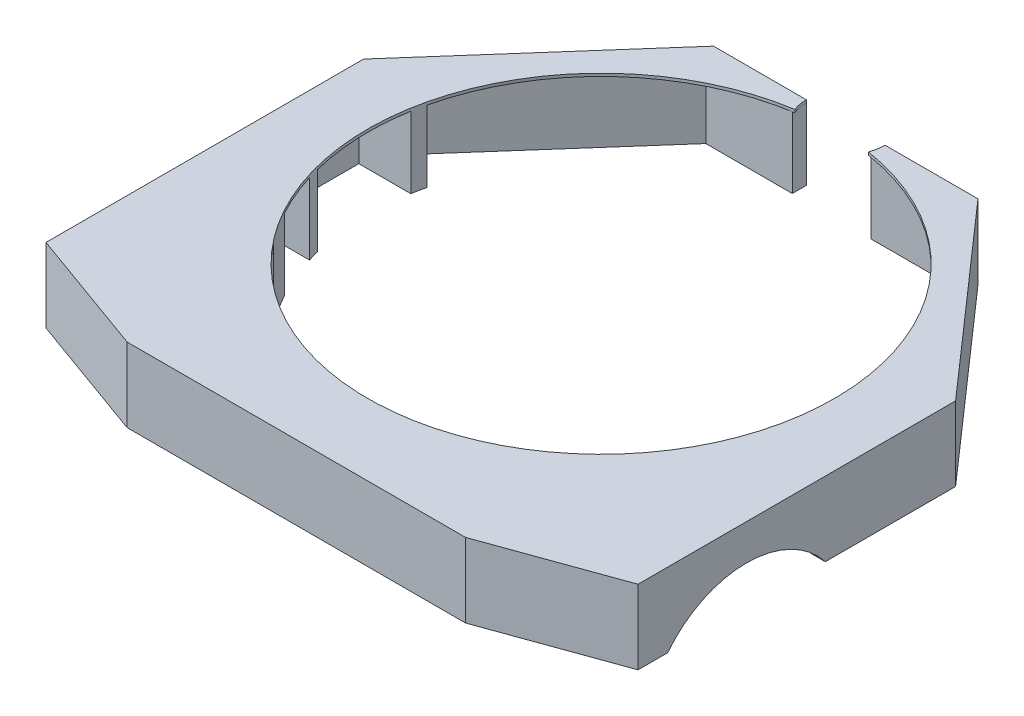
from build123d import *

# Parameters (mm, degrees)
BOSS_EXTRUDE1_DEPTH     = 63.399999946
BOSS_EXTRUDE2_DEPTH     = 63.399999946
BOSS_EXTRUDE3_DEPTH     = 5
BOSS_EXTRUDE4_DEPTH     = 2.5
SKETCH8_W               = 50.000000076
SKETCH8_H               = 34.99999985
CUT_EXTRUDE2_DEPTH      = 12.5
CUT_EXTRUDE4_DEPTH      = 2.5
SKETCH10_W              = 9.999999939
SKETCH10_H              = 34.99999985
CUT_EXTRUDE5_DEPTH      = 2.5
BOSS_EXTRUDE6_DEPTH     = 58.399999946
BOSS_EXTRUDE7_DEPTH     = 63.399999946
CUT_EXTRUDE8_DEPTH      = 633.390638366
CUT_EXTRUDE8_DEPTH_BACK = 633.390638366
SKETCH13_R              = 207.367939984
CUT_EXTRUDE9_DEPTH      = 465.722133037
BOSS_EXTRUDE15_DEPTH    = 63.4


with BuildPart() as part:
    # Sketch1 → Boss-Extrude1 (new body)
    with BuildSketch(Plane(origin=(0, 0, 0), x_dir=(1, 0, 0), z_dir=(0, 1, 0))):
        Polygon((-304.507375635, 63.663075045), (-304.507375635, -102.743315535), (-191.856739857, -143.33813924), (108.841988943, -143.33813924), (221.492624721, -102.743315535), (221.492624721, 63.663075045), (218.992624721, 63.663075045), (218.992624721, -100.986845182), (108.405283491, -140.83813932), (-191.420034405, -140.83813932), (-302.007375635, -100.986845182), (-302.007375635, 63.663075045), align=None)
    extrude(amount=BOSS_EXTRUDE1_DEPTH)



with BuildPart() as body_2:
    # Sketch3 → Boss-Extrude2 (new body)
    with BuildSketch(Plane(origin=(0, 0, 0), x_dir=(1, 0, 0), z_dir=(0, 1, 0))):
        Polygon((-304.507375635, 179.416332489), (-159.011838483, 344.817501188), (75.997087569, 344.817501188), (221.492624721, 179.416332489), (221.492624721, 63.663075045), (218.992624721, 63.663075045), (218.992624721, 178.473242754), (74.866627441, 342.317501188), (-157.881378355, 342.317501188), (-302.007375635, 178.473242754), (-302.007375635, 63.663075045), (-304.507375635, 63.663075045), align=None)
    extrude(amount=BOSS_EXTRUDE2_DEPTH)


with BuildPart() as part_1:
    add(part.part)

    add(body_2.part)  # Boss-Extrude3 merges body 2
    # Sketch5 → Boss-Extrude3 (add)
    with BuildSketch(Plane(origin=(0, 0, 0), x_dir=(1, 0, 0), z_dir=(0, 1, 0))):
        Polygon((208.992624721, 174.700883815), (208.992624721, 63.663075045), (218.992624721, 63.663075045), (218.992624721, 178.473242754), (74.866627441, 342.317501188), (-157.881378355, 342.317501188), (-302.007375635, 178.473242754), (-302.007375635, 63.663075045), (-292.007375635, 63.663075045), (-292.007375635, 174.700883815), (-153.359537842, 332.317501188), (70.344786927, 332.317501188), align=None)
        Polygon((215.602428975, -91.579051987), (106.658461628, -130.83813932), (-189.673212543, -130.83813932), (-298.617179889, -91.579051987), (-302.007375635, -100.986845182), (-191.420034405, -140.83813932), (108.405283491, -140.83813932), (218.992624721, -100.986845182), align=None)
    extrude(amount=BOSS_EXTRUDE3_DEPTH)

    # Sketch6 → Boss-Extrude4 (add)
    with BuildSketch(Plane(origin=(0, 63.399999946, 0), x_dir=(1, 0, 0), z_dir=(0, 1, 0))):
        Polygon((-159.011838483, 344.817501188), (-304.507375635, 179.416332489), (-304.507375635, -102.743315535), (-191.856739857, -143.33813924), (108.841988943, -143.33813924), (221.492624721, -102.743315535), (221.492624721, 179.416332489), (75.997087569, 344.817501188), align=None)
    extrude(amount=BOSS_EXTRUDE4_DEPTH)

    # Sketch8 → Cut-Extrude2 (cut)
    with BuildSketch(Plane(origin=(0, 0, -344.817501188), x_dir=(-1, 0, 0), z_dir=(0, 0, -1))):
        Polygon((6.50737548, 28.400000096), (6.50737548, 0), (76.507375434, 0), (76.507375434, 28.400000096), (66.507375495, 28.400000096), (16.507375419, 28.400000096), align=None)
        with Locations((41.507375457, 45.900000021)):
            Rectangle(SKETCH8_W, SKETCH8_H)
    extrude(amount=-CUT_EXTRUDE2_DEPTH, mode=Mode.SUBTRACT)

    # Sketch9 → Cut-Extrude4 (cut)
    with BuildSketch(Plane(origin=(0, 65.899999946, 0), x_dir=(1, 0, 0), z_dir=(0, 1, 0))):
        with BuildLine():
            ThreePointArc((-76.507375434, 344.817501188), (-41.507375457, 309.817501211), (-6.50737548, 344.817501188))
            Line((-6.50737548, 344.817501188), (-16.507375419, 344.817501188))
            Line((-16.507375419, 344.817501188), (-66.507375495, 344.817501188))
            Line((-66.507375495, 344.817501188), (-76.507375434, 344.817501188))
        make_face()
        with BuildLine():
            Line((-16.507375419, 344.817501188), (-6.50737548, 344.817501188))
            ThreePointArc((-6.50737548, 344.817501188), (-41.507375457, 379.817501165), (-76.507375434, 344.817501188))
            Line((-76.507375434, 344.817501188), (-66.507375495, 344.817501188))
            Line((-66.507375495, 344.817501188), (-16.507375419, 344.817501188))
        make_face()
    extrude(amount=-CUT_EXTRUDE4_DEPTH, mode=Mode.SUBTRACT)

    # Sketch10 → Cut-Extrude5 (cut)
    with BuildSketch(Plane(origin=(0, 0, -344.817501188), x_dir=(-1, 0, 0), z_dir=(0, 0, -1))):
        with Locations((11.50737545, 45.900000021)):
            Rectangle(SKETCH10_W, SKETCH10_H)
        with Locations((71.507375465, 45.900000021)):
            Rectangle(SKETCH10_W, SKETCH10_H)
    extrude(amount=-CUT_EXTRUDE5_DEPTH, mode=Mode.SUBTRACT)

    # Sketch11 → Boss-Extrude6 (add)
    with BuildSketch(Plane(origin=(0, 5, 0), x_dir=(1, 0, 0), z_dir=(0, 1, 0))):
        Polygon((-76.507375434, 332.317501188), (-76.507375434, 342.317501188), (-157.881378355, 342.317501188), (-302.007375635, 178.473242754), (-302.007375635, 63.663075045), (-292.007375635, 63.663075045), (-292.007375635, 174.700883815), (-153.359537842, 332.317501188), align=None)
        Polygon((208.992624721, 63.663075045), (218.992624721, 63.663075045), (218.992624721, 178.473242754), (74.866627441, 342.317501188), (-6.50737548, 342.317501188), (-6.50737548, 332.317501188), (70.344786927, 332.317501188), (208.992624721, 174.700883815), align=None)
        Polygon((108.405283491, -140.83813932), (218.992624721, -100.986845182), (215.602428975, -91.579051987), (106.658461628, -130.83813932), (-189.673212543, -130.83813932), (-298.617179889, -91.579051987), (-302.007375635, -100.986845182), (-191.420034405, -140.83813932), align=None)
    extrude(amount=BOSS_EXTRUDE6_DEPTH)

    # Sketch12 → Boss-Extrude7 (add)
    with BuildSketch(Plane.XZ):
        Polygon((-302.007375635, 100.986845182), (-302.007375635, -63.663075045), (-292.007375635, -63.663075045), (-292.007375635, 93.96096343), (-298.617179889, 91.579051987), align=None)
        Polygon((218.992624721, 100.986845182), (218.992624721, -63.663075045), (208.992624721, -63.663075045), (208.992624721, 93.96096343), (215.602428975, 91.579051987), align=None)
    extrude(amount=-BOSS_EXTRUDE7_DEPTH)

    # Sketch2 → Cut-Extrude8 (cut, two sides: drawn at the far end of the back side and taken through both)
    with BuildSketch(Plane.ZY.offset(304.507375635).offset(-CUT_EXTRUDE8_DEPTH_BACK)):
        with BuildLine():
            ThreePointArc((-63.663075045, 0), (-22.645494652, -138.842602216), (95.238139156, -54.800000095))
            ThreePointArc((95.238139156, -54.800000095), (90.380741277, -25.816366286), (76.339353357, 0))
            Line((76.339353357, 0), (-63.663075045, 0))
        make_face()
        with BuildLine():
            Line((-63.663075045, 0), (76.339353357, 0))
            ThreePointArc((76.339353357, 0), (6.338139156, 34.099999905), (-63.663075045, 0))
        make_face()
    extrude(amount=CUT_EXTRUDE8_DEPTH + CUT_EXTRUDE8_DEPTH_BACK, mode=Mode.SUBTRACT)

    # Sketch13 → Cut-Extrude9 (cut, through all)
    with BuildSketch(Plane(origin=(0, 65.899999946, 0), x_dir=(1, 0, 0), z_dir=(0, 1, 0))):
        with Locations((-41.507375457, 127.449561204)):
            Circle(SKETCH13_R)
    extrude(amount=-CUT_EXTRUDE9_DEPTH, mode=Mode.SUBTRACT)

    # Sketch16 → Boss-Extrude15 (add, through all)
    with BuildSketch(Plane.XZ.offset(-63.399999946)):
        with BuildLine():
            Line((-292.007375635, -174.700883815), (-243.420166148, -174.700883815))
            ThreePointArc((-243.420166148, -174.700883815), (-244.727222578, -168.718875101), (-245.857092333, -162.700883815))
            Line((-245.857092333, -162.700883815), (-292.007375635, -162.700883815))
            Line((-292.007375635, -162.700883815), (-292.007375635, -174.700883815))
        make_face()
        with BuildLine():
            Line((-292.007375635, -66.656438986), (-239.763923455, -66.656438986))
            ThreePointArc((-239.763923455, -66.656438986), (-241.223768745, -71.638945859), (-242.558416908, -76.656438986))
            Line((-242.558416908, -76.656438986), (-292.007375635, -76.656438986))
            Line((-292.007375635, -76.656438986), (-292.007375635, -66.656438986))
        make_face()
        with BuildLine():
            Line((-223.513560978, 118.643419163), (-223.513560978, -28.075465156))
            ThreePointArc((-223.513560978, -28.075465156), (-214.696000108, -13.400611956), (-204.697974588, 0.496876373))
            Line((-204.697974588, 0.496876373), (-204.697974588, 125.423810655))
            Line((-204.697974588, 125.423810655), (-223.513560978, 118.643419163))
        make_face()
        with BuildLine():
            Line((-189.673212543, 130.83813932), (-189.673212543, 17.63092423))
            ThreePointArc((-189.673212543, 17.63092423), (-182.344298329, 24.755641365), (-174.673212543, 31.510567025))
            Line((-174.673212543, 31.510567025), (-174.673212543, 115.83813932))
            Line((-174.673212543, 115.83813932), (91.658461628, 115.83813932))
            Line((91.658461628, 115.83813932), (91.658461628, 31.510567025))
            ThreePointArc((91.658461628, 31.510567025), (99.329547415, 24.755641365), (106.658461628, 17.63092423))
            Line((106.658461628, 17.63092423), (106.658461628, 130.83813932))
            Line((106.658461628, 130.83813932), (-189.673212543, 130.83813932))
        make_face()
        with BuildLine():
            Line((121.683223673, 125.423810655), (121.683223673, 0.496876373))
            ThreePointArc((121.683223673, 0.496876373), (131.681249194, -13.400611956), (140.498810064, -28.075465156))
            Line((140.498810064, -28.075465156), (140.498810064, 118.643419163))
            Line((140.498810064, 118.643419163), (121.683223673, 125.423810655))
        make_face()
        with BuildLine():
            Line((208.992624721, -66.656438986), (156.749172541, -66.656438986))
            ThreePointArc((156.749172541, -66.656438986), (158.115408542, -71.30504552), (159.372662829, -75.984303492))
            Line((159.372662829, -75.984303492), (208.992624721, -75.984303492))
            Line((208.992624721, -75.984303492), (208.992624721, -66.656438986))
        make_face()
        with BuildLine():
            Line((208.992624721, -174.700883815), (160.405415234, -174.700883815))
            ThreePointArc((160.405415234, -174.700883815), (161.712471663, -168.718875101), (162.842341419, -162.700883815))
            Line((162.842341419, -162.700883815), (208.992624721, -162.700883815))
            Line((208.992624721, -162.700883815), (208.992624721, -174.700883815))
        make_face()
    extrude(amount=BOSS_EXTRUDE15_DEPTH)


solid = part_1.part
